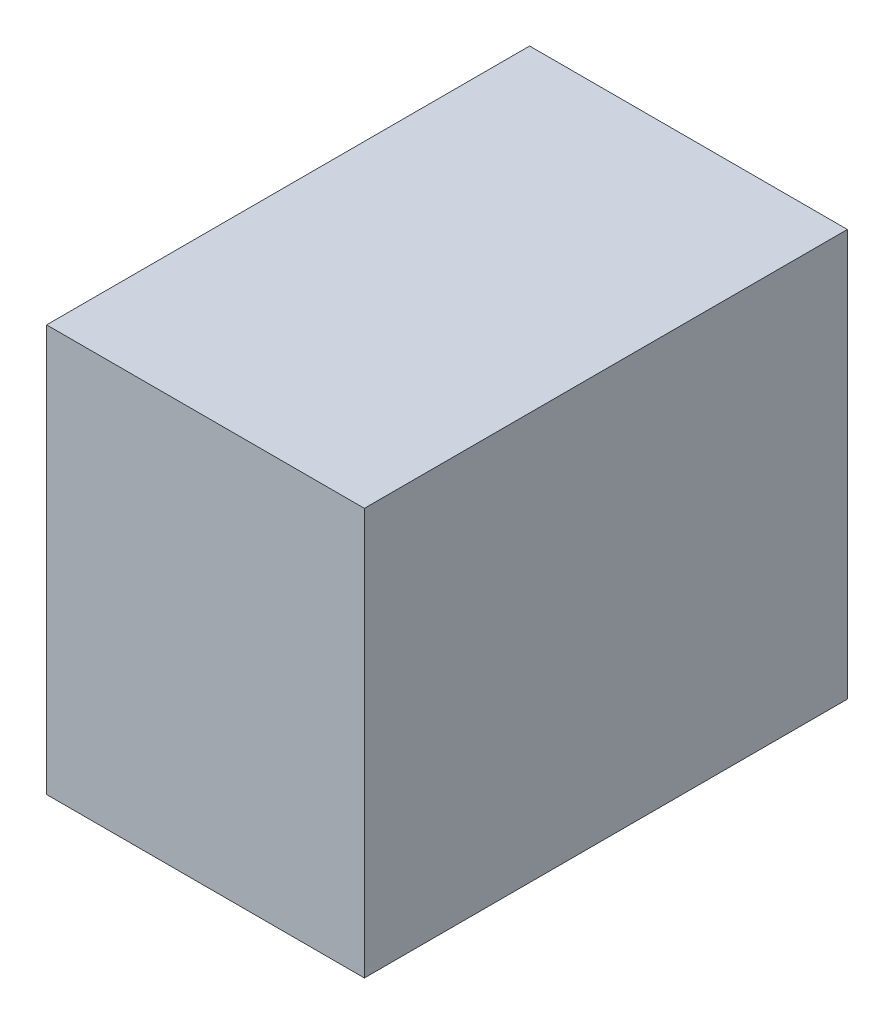
from build123d import *

# Parameters (mm, degrees)
SKETCH1_W           = 25
SKETCH1_H           = 32
BOSS_EXTRUDE1_DEPTH = 38


with BuildPart() as part:
    # Sketch1 → Boss-Extrude1 (new body)
    with BuildSketch(Plane.XY):
        with Locations((15.4, 12.138329701)):
            Rectangle(SKETCH1_W, SKETCH1_H)
    extrude(amount=BOSS_EXTRUDE1_DEPTH)


solid = part.part
